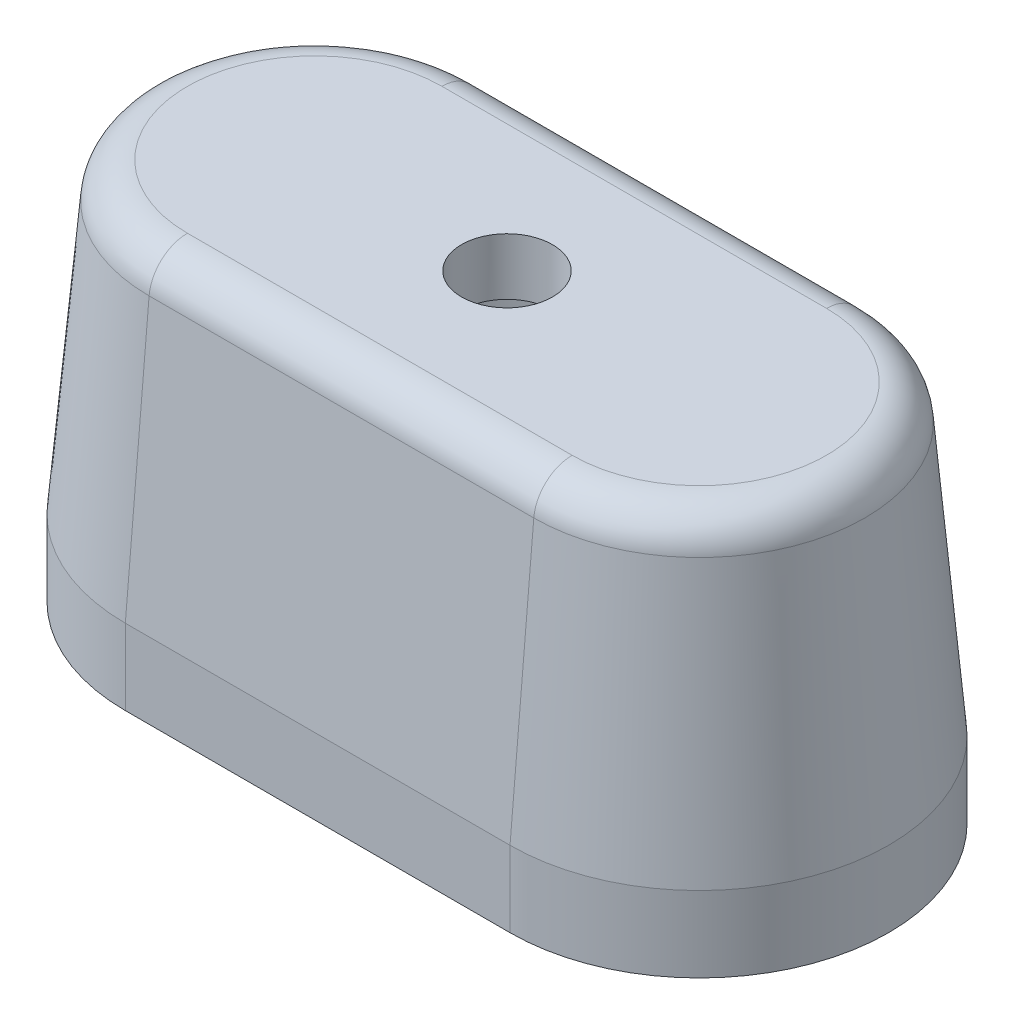
from build123d import *

# Parameters (mm, degrees)
SKETCH1_W           = 102.87
SKETCH1_H           = 52.07
BOSS_EXTRUDE2_DEPTH = 10
BOSS_EXTRUDE3_DEPTH = 40.5
BOSS_EXTRUDE3_TAPER = 5
SKETCH4_R           = 21.25
CUT_EXTRUDE2_DEPTH  = 43
FILLET1_R           = 5.08
SKETCH5_R           = 6
CUT_EXTRUDE3_DEPTH  = 77.639614104
SKETCH6_OUTSIDE_W   = 130.044
SKETCH6_OUTSIDE_H   = 79.244
CUT_EXTRUDE4_DEPTH  = 71.453037195


with BuildPart() as part:
    # Sketch1 → Boss-Extrude2 (new body)
    with BuildSketch(Plane(origin=(0, 0, 0), x_dir=(1, 0, 0), z_dir=(0, 1, 0))):
        Rectangle(SKETCH1_W, SKETCH1_H)
    extrude(amount=BOSS_EXTRUDE2_DEPTH)

    # Sketch3 → Boss-Extrude3 (add)
    with BuildSketch(Plane(origin=(0, 10, 0), x_dir=(1, 0, 0), z_dir=(0, 1, 0))):
        with BuildLine():
            ThreePointArc((-25.4, 25.000000038), (-50.400000038, 0), (-25.4, -25.000000038))
            Line((-25.4, -25.000000038), (25.4, -25.000000038))
            ThreePointArc((25.4, -25.000000038), (50.400000038, 0), (25.4, 25.000000038))
            Line((25.4, 25.000000038), (-25.4, 25.000000038))
        make_face()
    extrude(amount=BOSS_EXTRUDE3_DEPTH, taper=BOSS_EXTRUDE3_TAPER)

    # Sketch4 → Cut-Extrude2 (cut)
    with BuildSketch(Plane.XZ):
        with Locations(Location((0, 0, 0), (0, 0, 270))):
            Circle(SKETCH4_R)
    extrude(amount=-CUT_EXTRUDE2_DEPTH, mode=Mode.SUBTRACT)

    # Fillet1
    fillet1_edges = [part.edges().sort_by_distance(p)[0] for p in [
        (-46.856709165, 50.5, 0),
        (0, 50.5, 21.456709165),
        (46.856709165, 50.5, 0),
        (0, 50.5, -21.456709165),
    ]]
    fillet(fillet1_edges, radius=FILLET1_R)

    # Sketch5 → Cut-Extrude3 (cut, through all)
    with BuildSketch(Plane(origin=(0, 50.5, 0), x_dir=(1, 0, 0), z_dir=(0, 1, 0))):
        with Locations(Location((0, 0, 0), (0, 0, 270))):
            Circle(SKETCH5_R)
    extrude(amount=-CUT_EXTRUDE3_DEPTH, mode=Mode.SUBTRACT)

    # Sketch6 outside → Cut-Extrude4 (cut, through all)
    with BuildSketch(Plane(origin=(0, 10, 0), x_dir=(1, 0, 0), z_dir=(0, 1, 0))):
        Rectangle(SKETCH6_OUTSIDE_W, SKETCH6_OUTSIDE_H)
        with BuildLine():
            Line((-25.4, 25.000000038), (25.4, 25.000000038))
            ThreePointArc((25.4, 25.000000038), (50.400000038, 0), (25.4, -25.000000038))
            Line((25.4, -25.000000038), (-25.4, -25.000000038))
            ThreePointArc((-25.4, -25.000000038), (-50.400000038, 0), (-25.4, 25.000000038))
        make_face(mode=Mode.SUBTRACT)
    extrude(amount=-CUT_EXTRUDE4_DEPTH, mode=Mode.SUBTRACT)


solid = part.part
